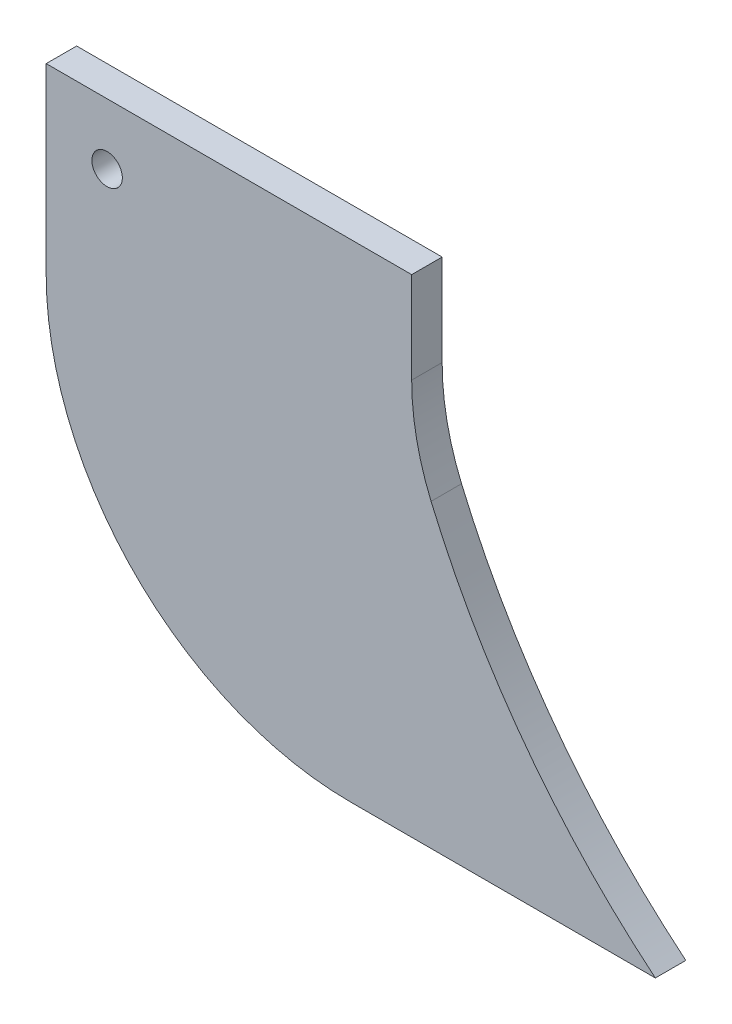
from build123d import *

# Parameters (mm, degrees)
SKETCH1_R           = 3.175
BOSS_EXTRUDE1_DEPTH = 6.35


with BuildPart() as part:
    # Sketch1 → Boss-Extrude1 (new body)
    with BuildSketch(Plane.XY):
        with BuildLine():
            Line((63.5, 0), (127, 0))
            ThreePointArc((127, 0), (99.857277989, 28.53470612), (80.244706938, 62.685897436))
            ThreePointArc((80.244706938, 62.685897436), (77.221445945, 72.414145018), (76.2, 82.55))
            Line((76.2, 82.55), (76.2, 101.6))
            Line((76.2, 101.6), (0, 101.6))
            Line((0, 101.6), (0, 63.5))
            ThreePointArc((0, 63.5), (18.598719395, 18.598719395), (63.5, 0))
        make_face()
        with Locations((12.7, 88.9)):
            Circle(SKETCH1_R, mode=Mode.SUBTRACT)
    extrude(amount=BOSS_EXTRUDE1_DEPTH)


solid = part.part
